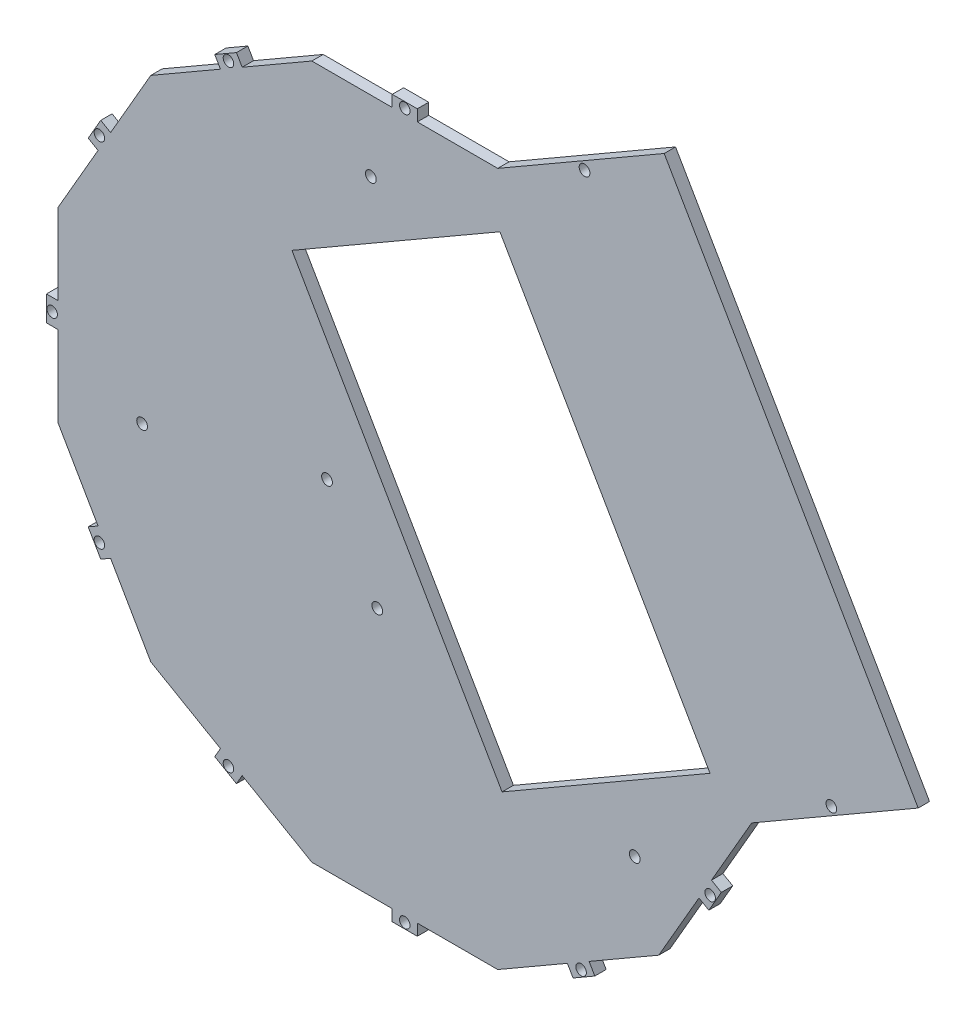
from build123d import *

# Parameters (mm, degrees)
BOSS_EXTRUDE1_DEPTH = 3.175
SKETCH3_R           = 1.47
CUT_EXTRUDE5_DEPTH  = 10
CUT_EXTRUDE6_DEPTH  = 10
BOSS_EXTRUDE2_DEPTH = 3.175
SKETCH7_R           = 1.5
CUT_EXTRUDE7_DEPTH  = 10
SKETCH9_R           = 1.5
CUT_EXTRUDE9_DEPTH  = 10
CUT_EXTRUDE10_DEPTH = 10
SKETCH11_R          = 1.5
CUT_EXTRUDE11_DEPTH = 10


with BuildPart() as part:
    # Sketch1 → Boss-Extrude1 (new body)
    with BuildSketch(Plane.XY):
        Polygon((-26.794919243, 100), (26.794919243, 100), (73.205080757, 73.205080757), (100, 26.794919243), (100, -26.794919243), (73.205080757, -73.205080757), (26.794919243, -100), (-26.794919243, -100), (-73.205080757, -73.205080757), (-100, -26.794919243), (-100, 26.794919243), (-73.205080757, 73.205080757), align=None)
    extrude(amount=BOSS_EXTRUDE1_DEPTH)

    # Sketch3 → Cut-Extrude5 (cut)
    with BuildSketch(Plane(origin=(0, 0, 0), x_dir=(-1, 0, 0), z_dir=(0, 0, -1))):
        Polygon((51.443588913, -82.102909721), (53.031088913, -84.852540378), (73.205080757, -73.205080757), (84.852540378, -53.031088913), (82.102909721, -51.443588913), (70.880819443, -70.880819443), align=None)
        Polygon((-26.794919243, -100), (-3.5, -100), (-3.5, -96.825), (-25.944180557, -96.825), (-45.381411087, -85.602909721), (-46.968911087, -88.352540378), align=None)
        Polygon((-73.205080757, -73.205080757), (-53.031088913, -84.852540378), (-51.443588913, -82.102909721), (-70.880819443, -70.880819443), (-82.102909721, -51.443588913), (-84.852540378, -53.031088913), align=None)
        with Locations((-49.20625, -85.22772505)):
            Circle(SKETCH3_R)
        Polygon((-100, -26.794919243), (-88.352540378, -46.968911087), (-85.602909721, -45.381411087), (-96.825, -25.944180557), (-96.825, -3.5), (-100, -3.5), align=None)
        Polygon((-100, 26.794919243), (-100, 3.5), (-96.825, 3.5), (-96.825, 25.944180557), (-85.602909721, 45.381411087), (-88.352540378, 46.968911087), align=None)
        Polygon((-26.794919243, 100), (-46.968911087, 88.352540378), (-45.381411087, 85.602909721), (-25.944180557, 96.825), (-3.5, 96.825), (-3.5, 100), align=None)
        Polygon((26.794919243, 100), (3.5, 100), (3.5, 96.825), (25.944180557, 96.825), (45.381411087, 85.602909721), (46.968911087, 88.352540378), align=None)
        Polygon((73.205080757, 73.205080757), (53.031088913, 84.852540378), (51.443588913, 82.102909721), (70.880819443, 70.880819443), (82.102909721, 51.443588913), (84.852540378, 53.031088913), align=None)
        with Locations((-85.22772505, 49.20625)):
            Circle(SKETCH3_R)
        with Locations((-49.20625, 85.22772505)):
            Circle(SKETCH3_R)
        with Locations((0, 98.4125)):
            Circle(SKETCH3_R)
        with Locations((49.20625, 85.22772505)):
            Circle(SKETCH3_R)
        with Locations((85.22772505, 49.20625)):
            Circle(SKETCH3_R)
        with Locations((98.4125, 0)):
            Circle(SKETCH3_R)
        Polygon((96.825, -3.5), (96.825, -25.944180557), (85.602909721, -45.381411087), (88.352540378, -46.968911087), (100, -26.794919243), (100, -3.5), align=None)
        with Locations((85.22772505, -49.20625)):
            Circle(SKETCH3_R)
        Polygon((45.381411087, -85.602909721), (25.944180557, -96.825), (3.5, -96.825), (3.5, -100), (26.794919243, -100), (46.968911087, -88.352540378), align=None)
        with Locations((0, -98.4125)):
            Circle(SKETCH3_R)
        with Locations((49.20625, -85.22772505)):
            Circle(SKETCH3_R)
        with Locations((-85.22772505, -49.20625)):
            Circle(SKETCH3_R)
        with Locations((-98.4125, 0)):
            Circle(SKETCH3_R)
        Polygon((-82.102909721, 51.443588913), (-70.880819443, 70.880819443), (-51.443588913, 82.102909721), (-53.031088913, 84.852540378), (-73.205080757, 73.205080757), (-84.852540378, 53.031088913), align=None)
        Polygon((100, 26.794919243), (88.352540378, 46.968911087), (85.602909721, 45.381411087), (96.825, 25.944180557), (96.825, 3.5), (100, 3.5), align=None)
    extrude(amount=-CUT_EXTRUDE5_DEPTH, mode=Mode.SUBTRACT)

    # Sketch4 → Cut-Extrude6 (cut)
    with BuildSketch(Plane.XY.offset(3.175)):
        Polygon((27.531680557, 99.574630657), (25.944180557, 96.825), (96.825, -25.944180557), (100, -25.944180557), (100, 27.816263625), (73.190593106, 73.213445206), align=None)
    extrude(amount=-CUT_EXTRUDE6_DEPTH, mode=Mode.SUBTRACT)

    # Sketch5 → Boss-Extrude2 (add)
    with BuildSketch(Plane.XY.offset(3.175)):
        Polygon((96.825, -25.944180557), (143.278603525, 0.875819943), (72.397784082, 123.6450005), (25.944180557, 96.825), align=None)
    extrude(amount=-BOSS_EXTRUDE2_DEPTH)

    # Sketch7 → Cut-Extrude7 (cut)
    with BuildSketch(Plane(origin=(0, 0, 0), x_dir=(-1, 0, 0), z_dir=(0, 0, -1))):
        with Locations((-119.051801763, -10.8021295)):
            Circle(SKETCH7_R)
        with Locations((-50.17098232, 108.502949442)):
            Circle(SKETCH7_R)
    extrude(amount=-CUT_EXTRUDE7_DEPTH, mode=Mode.SUBTRACT)

    # Sketch9 → Cut-Extrude9 (cut)
    with BuildSketch(Plane(origin=(0, 0, 0), x_dir=(-1, 0, 0), z_dir=(0, 0, -1))):
        with Locations((73.306739868, -14.507270856)):
            Circle(SKETCH9_R)
        with Locations((21.70291705, -2.187552088)):
            Circle(SKETCH9_R)
        with Locations((7.673469234, -26.303617148)):
            Circle(SKETCH9_R)
    extrude(amount=-CUT_EXTRUDE9_DEPTH, mode=Mode.SUBTRACT)

    # Sketch10 → Cut-Extrude10 (cut)
    with BuildSketch(Plane.XY.offset(3.175)):
        Polygon((27.153871113, -53.276548933), (85.191651102, -19.768396257), (26.553283992, 81.796259373), (-31.484495997, 48.288106697), align=None)
    extrude(amount=-CUT_EXTRUDE10_DEPTH, mode=Mode.SUBTRACT)

    # Sketch11 → Cut-Extrude11 (cut)
    with BuildSketch(Plane.XY.offset(3.175)):
        with Locations((64.18037908, -50.392061509)):
            Circle(SKETCH11_R)
        with Locations((-9.45962092, 77.156159961)):
            Circle(SKETCH11_R)
    extrude(amount=-CUT_EXTRUDE11_DEPTH, mode=Mode.SUBTRACT)


solid = part.part
